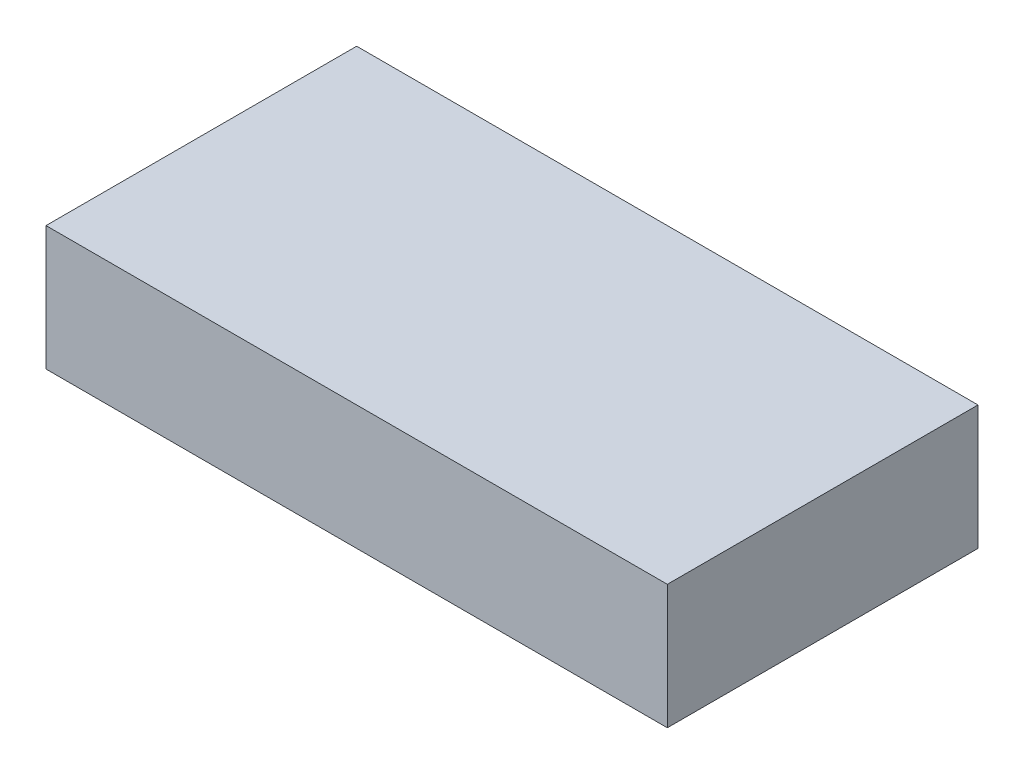
from build123d import *

# Parameters (mm, degrees)
SKETCH_1_W      = 10
SKETCH_1_H      = 5
EXTRUDE_1_DEPTH = 2


with BuildPart() as part:
    # Эскиз1 → Бобышка-Вытянуть1 (new body)
    with BuildSketch(Plane(origin=(0, 0, 0), x_dir=(1, 0, 0), z_dir=(0, 1, 0))):
        Rectangle(SKETCH_1_W, SKETCH_1_H)
    extrude(amount=EXTRUDE_1_DEPTH)


solid = part.part
